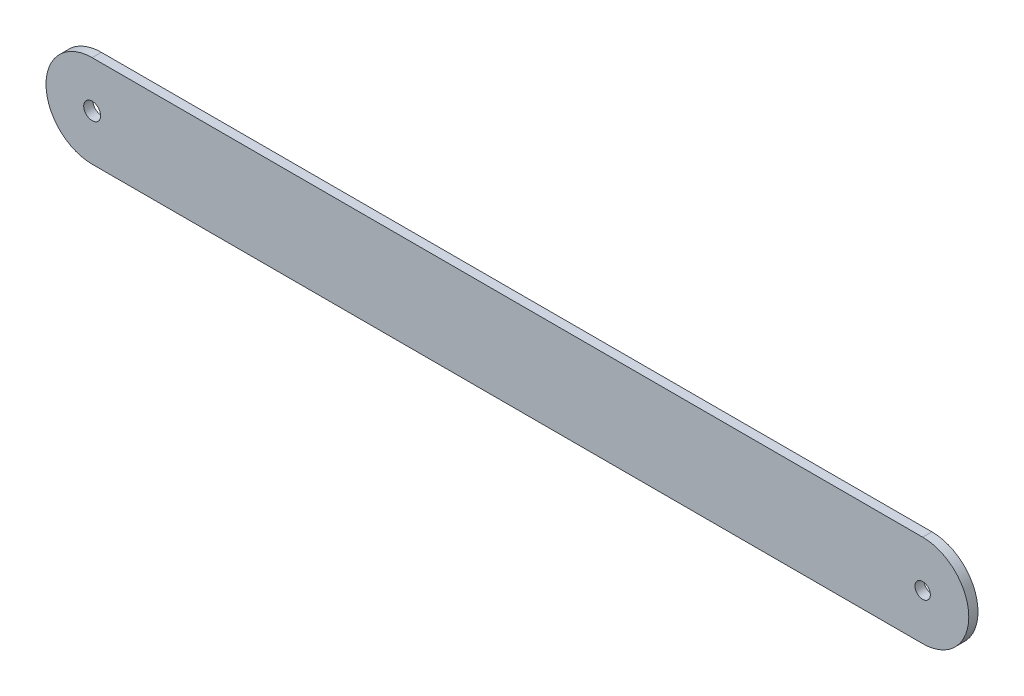
from build123d import *

# Parameters (mm, degrees)
SKETCH_1_R      = 2.75
SKETCH_1_R_2    = 2.5
EXTRUDE_1_DEPTH = 3


with BuildPart() as part:
    # 草图1 → 凸台-拉伸1 (new body)
    with BuildSketch(Plane.XY):
        with BuildLine():
            Line((-15.76602808, 45.286446481), (-285.76602808, 45.286446481))
            ThreePointArc((-285.76602808, 45.286446481), (-300.76602808, 30.286446481), (-285.76602808, 15.286446481))
            Line((-285.76602808, 15.286446481), (-15.76602808, 15.286446481))
            ThreePointArc((-15.76602808, 15.286446481), (-0.76602808, 30.286446481), (-15.76602808, 45.286446481))
        make_face()
        with Locations((-285.76602808, 30.286446481)):
            Circle(SKETCH_1_R, mode=Mode.SUBTRACT)
        with Locations((-15.76602808, 30.286446481)):
            Circle(SKETCH_1_R_2, mode=Mode.SUBTRACT)
    extrude(amount=EXTRUDE_1_DEPTH)


solid = part.part
